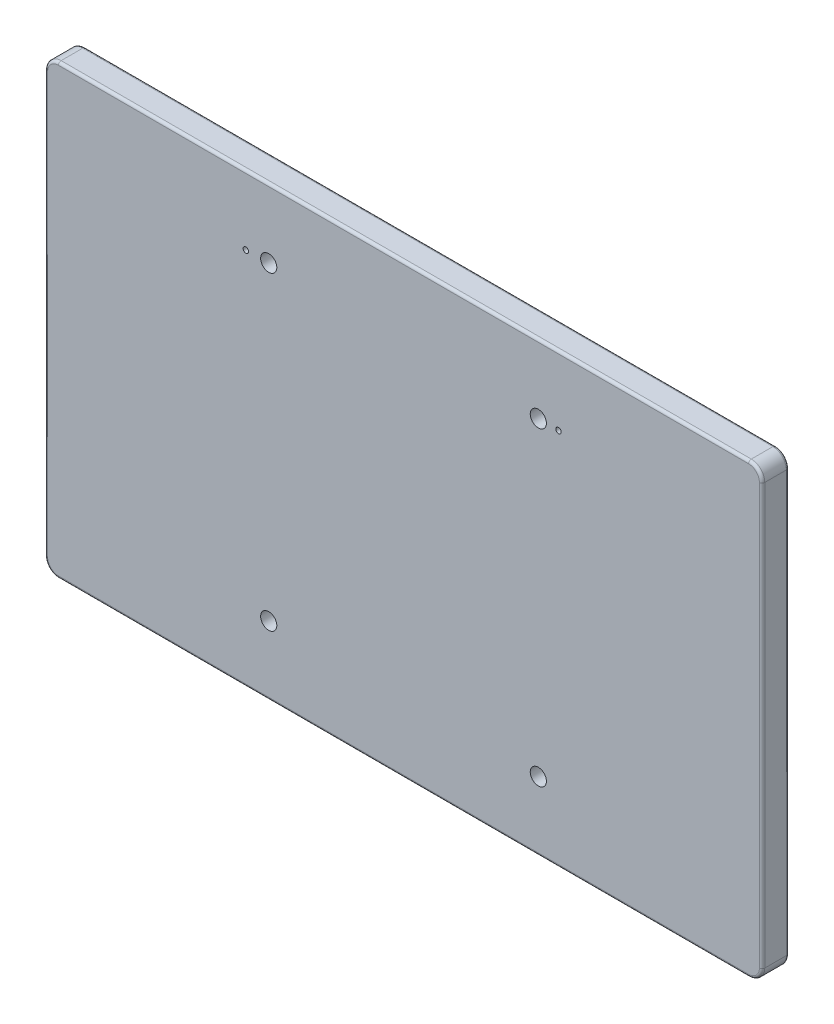
from build123d import *

# Parameters (mm, degrees)
BOSS_EXTRUDE1_DEPTH     = 10
FILLET1_R               = 5
CUT_EXTRUDE1_DEPTH      = 207.767985917
CUT_EXTRUDE1_DEPTH_BACK = 207.767985917
SKETCH2_R               = 3
FILLET2_R               = 1
SKETCH4_R               = 1
CUT_EXTRUDE2_DEPTH      = 207.767985981


with BuildPart() as part:
    # Sketch1 → Boss-Extrude1 (new body)
    with BuildSketch(Plane.XY):
        Polygon((125, 158), (-125, 158), (-133, 158), (-133, 150), (-133, 0), (-133, -8), (-125, -8), (125, -8), (133, -8), (133, 0), (133, 150), (133, 158), align=None)
    extrude(amount=BOSS_EXTRUDE1_DEPTH)

    # Fillet1
    fillet1_edges = [part.edges().sort_by_distance(p)[0] for p in [
        (-133, -8, 5),
        (133, -8, 5),
        (133, 158, 5),
        (-133, 158, 5),
    ]]
    fillet(fillet1_edges, radius=FILLET1_R)

    # Sketch2 → Cut-Extrude1 (cut, two sides: drawn at the far end of the back side and taken through both)
    with BuildSketch(Plane(origin=(0, 0, 0), x_dir=(-1, 0, 0), z_dir=(0, 0, -1)).offset(-CUT_EXTRUDE1_DEPTH_BACK)):
        with Locations(Location((-50, 132.5, 0), (0, 0, 180))):
            Circle(SKETCH2_R)
        with Locations(Location((50, 132.5, 0), (0, 0, 180))):
            Circle(SKETCH2_R)
        with Locations(Location((-50, 17.5, 0), (0, 0, 180))):
            Circle(SKETCH2_R)
        with Locations(Location((50, 17.5, 0), (0, 0, 180))):
            Circle(SKETCH2_R)
    extrude(amount=CUT_EXTRUDE1_DEPTH + CUT_EXTRUDE1_DEPTH_BACK, mode=Mode.SUBTRACT)

    # Fillet2
    fillet2_edges = [part.edges().sort_by_distance(p)[0] for p in [
        (0, -8, 10),
        (0, -8, 0),
        (131.535533906, -6.535533906, 10),
        (-131.535533906, -6.535533906, 10),
        (133, 75, 10),
        (-133, 75, 10),
        (131.535533906, 156.535533906, 10),
        (-131.535533906, 156.535533906, 10),
        (0, 158, 10),
        (131.535533906, -6.535533906, 0),
        (-131.535533906, -6.535533906, 0),
        (-133, 75, 0),
        (133, 75, 0),
        (-131.535533906, 156.535533906, 0),
        (131.535533906, 156.535533906, 0),
        (0, 158, 0),
    ]]
    fillet(fillet2_edges, radius=FILLET2_R)

    # Sketch4 → Cut-Extrude2 (cut, through all)
    with BuildSketch(Plane(origin=(0, 0, 0), x_dir=(-1, 0, 0), z_dir=(0, 0, -1))):
        with Locations((58.5, 132.4)):
            Circle(SKETCH4_R)
        with Locations((-57.5, 132.4)):
            Circle(SKETCH4_R)
    extrude(amount=-CUT_EXTRUDE2_DEPTH, mode=Mode.SUBTRACT)


solid = part.part
